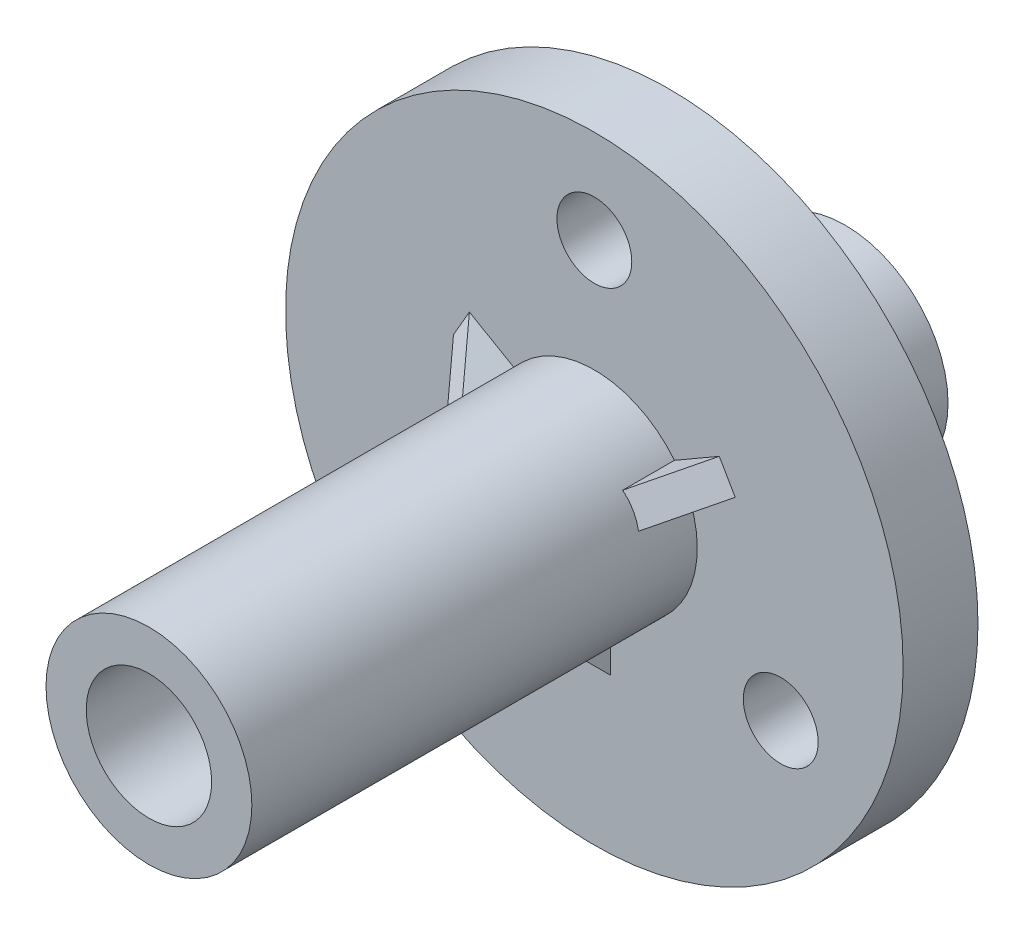
from build123d import *

# Parameters (mm, degrees)
CROQUIS1_R              = 16.5
CROQUIS1_R_2            = 2
SALIENTE_EXTRUIR1_DEPTH = 4
CROQUIS2_R              = 5.5
SALIENTE_EXTRUIR2_DEPTH = 23.8
SALIENTE_EXTRUIR3_START = 9.4
CROQUIS3_R              = 5.5
SALIENTE_EXTRUIR3_DEPTH = 9.4
CROQUIS5_R              = 3.35
CORTAR_EXTRUIR1_DEPTH   = 37.2
SALIENTE_EXTRUIR7_DEPTH = 0.85
MATRIZC1_COUNT          = 3
SIMETR_A1_COPY_1_DEPTH  = 0.85
SIMETR_A1_COPY_2_DEPTH  = 0.85


with BuildPart() as part:
    # Croquis1 → Saliente-Extruir1 (new body)
    with BuildSketch(Plane.XY):
        Circle(CROQUIS1_R)
        with Locations((0, 11.5)):
            Circle(CROQUIS1_R_2, mode=Mode.SUBTRACT)
        with Locations((-9.959292144, -5.75)):
            Circle(CROQUIS1_R_2, mode=Mode.SUBTRACT)
        with Locations((9.959292144, -5.75)):
            Circle(CROQUIS1_R_2, mode=Mode.SUBTRACT)
    extrude(amount=SALIENTE_EXTRUIR1_DEPTH)

    # Croquis2 → Saliente-Extruir2 (add)
    with BuildSketch(Plane.XY.offset(4)):
        Circle(CROQUIS2_R)
    extrude(amount=SALIENTE_EXTRUIR2_DEPTH)

    # Croquis3 → Saliente-Extruir3 (add)
    with BuildSketch(Plane(origin=(0, 0, 0), x_dir=(-1, 0, 0), z_dir=(0, 0, -1)).offset(SALIENTE_EXTRUIR3_START)):
        with Locations(Location((0, 0, 0), (0, 0, 180))):
            Circle(CROQUIS3_R)
    extrude(amount=-SALIENTE_EXTRUIR3_DEPTH)

    # Croquis5 → Cortar-Extruir1 (cut)
    with BuildSketch(Plane.XY.offset(27.8)):
        Circle(CROQUIS5_R)
    extrude(amount=-CORTAR_EXTRUIR1_DEPTH, mode=Mode.SUBTRACT)

    # Croquis7 → Saliente-Extruir7 (add, symmetric)
    with BuildSketch(Plane(origin=(0, 0, 0), x_dir=(0, 0, -1), z_dir=(1, 0, 0))):
        Polygon((-4, -4.874650825), (-4, -5.5), (-6.7, -5.5), (-7.325349175, -4.874650825), align=None)
        Polygon((-6.7, -5.5), (-4, -8.2), (-4, -5.5), align=None)
    saliente_extruir7 = extrude(amount=SALIENTE_EXTRUIR7_DEPTH, both=True)

    # MatrizC1: Saliente-Extruir7 ×3 about axis
    matrizc1_axis = Axis((0, 0, -18.875230868), (0, 0, 1))
    for i in range(1, MATRIZC1_COUNT):
        add(saliente_extruir7.rotate(matrizc1_axis, i * 360 / MATRIZC1_COUNT))

    # Simetría1: Saliente-Extruir7 across plane
    add(saliente_extruir7.mirror(Plane.XY.offset(2)))

    # Simetría1 copy 1 sketch → Simetría1 copy 1 (add, symmetric)
    with BuildSketch(Plane(origin=(0, 0, 4), x_dir=(0, 0, 1), z_dir=(-0.4999999999999998, 0.8660254037844387, 0))):
        Polygon((-4, 4.874650825), (-4, 5.5), (-6.7, 5.5), (-7.325349175, 4.874650825), align=None)
        Polygon((-6.7, 5.5), (-4, 8.2), (-4, 5.5), align=None)
    extrude(amount=SIMETR_A1_COPY_1_DEPTH, both=True)

    # Simetría1 copy 2 sketch → Simetría1 copy 2 (add, symmetric)
    with BuildSketch(Plane(origin=(0, 0, 4), x_dir=(0, 0, 1), z_dir=(-0.5000000000000004, -0.8660254037844384, 0))):
        Polygon((-4, 4.874650825), (-4, 5.5), (-6.7, 5.5), (-7.325349175, 4.874650825), align=None)
        Polygon((-6.7, 5.5), (-4, 8.2), (-4, 5.5), align=None)
    extrude(amount=SIMETR_A1_COPY_2_DEPTH, both=True)


solid = part.part
